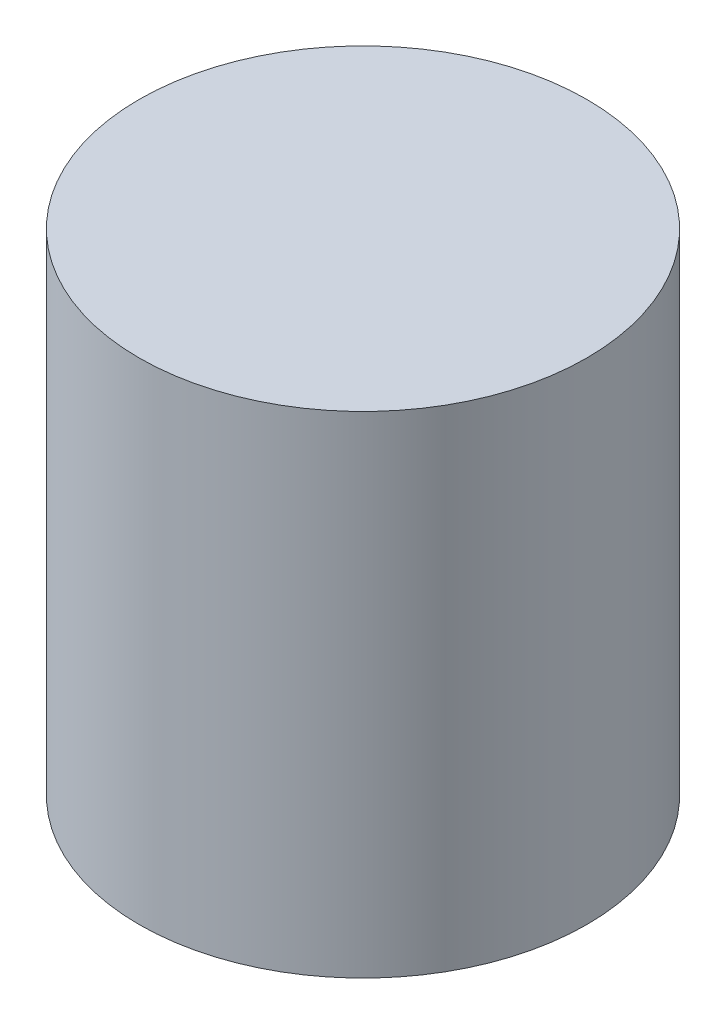
from build123d import *

# Parameters (mm, degrees)
SKETCH1_R           = 3.65
SKETCH1_R_2         = 3.15
BOSS_EXTRUDE1_DEPTH = 8
SKETCH2_R           = 3.518874361
BOSS_EXTRUDE2_DEPTH = 1


with BuildPart() as part:
    # Sketch1 → Boss-Extrude1 (new body)
    with BuildSketch(Plane(origin=(0, 0, 0), x_dir=(1, 0, 0), z_dir=(0, 1, 0))):
        with Locations(Location((0, 0, 0), (0, 0, 270))):
            Circle(SKETCH1_R)
        with Locations(Location((0, 0, 0), (0, 0, 270))):
            Circle(SKETCH1_R_2, mode=Mode.SUBTRACT)
    extrude(amount=BOSS_EXTRUDE1_DEPTH)

    # Sketch2 → Boss-Extrude2 (add)
    with BuildSketch(Plane(origin=(0, 8, 0), x_dir=(1, 0, 0), z_dir=(0, 1, 0))):
        Circle(SKETCH2_R)
    extrude(amount=-BOSS_EXTRUDE2_DEPTH)


solid = part.part
